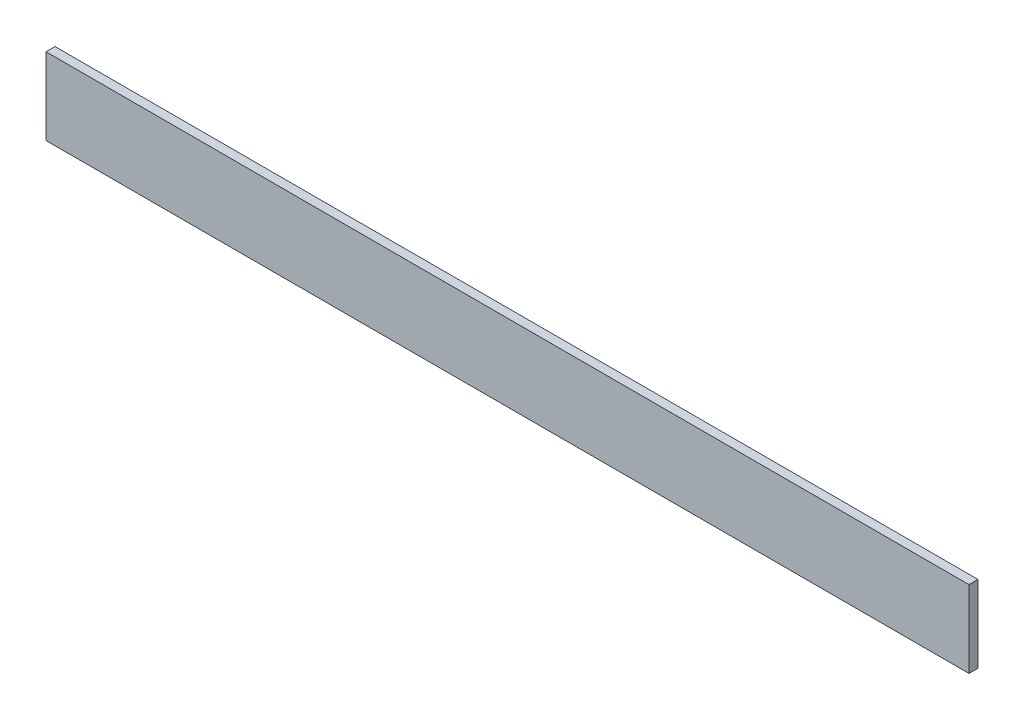
from build123d import *

# Parameters (mm, degrees)
SKETCH1_W           = 1219.2
SKETCH1_H           = 101.6
BOSS_EXTRUDE1_DEPTH = 11.90625


with BuildPart() as part:
    # Sketch1 → Boss-Extrude1 (new body)
    with BuildSketch(Plane.XY):
        Rectangle(SKETCH1_W, SKETCH1_H)
    extrude(amount=BOSS_EXTRUDE1_DEPTH)


solid = part.part
